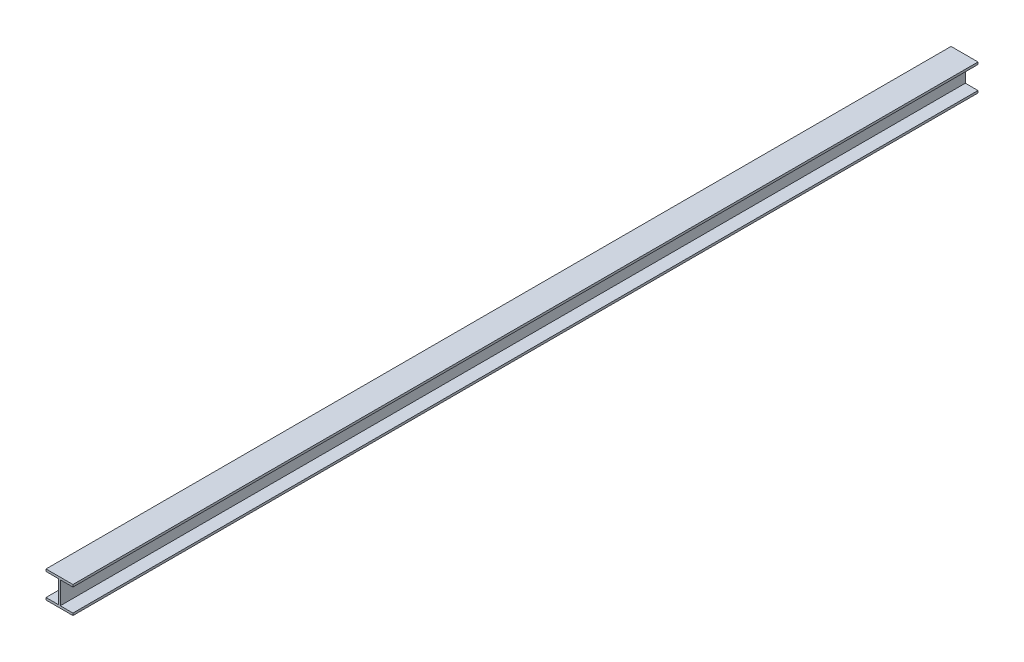
from build123d import *

# Parameters (mm, degrees)
BOSS_EXTRUDE1_DEPTH = 4267.2


with BuildPart() as part:
    # Sketch1 → Boss-Extrude1 (new body)
    with BuildSketch(Plane.XY):
        Polygon((0, 0), (127, 0), (127, 10.4648), (67.4751, 10.4648), (67.4751, 116.5352), (127, 116.5352), (127, 127), (0, 127), (0, 116.5352), (59.5249, 116.5352), (59.5249, 10.4648), (0, 10.4648), align=None)
    extrude(amount=BOSS_EXTRUDE1_DEPTH)


solid = part.part
